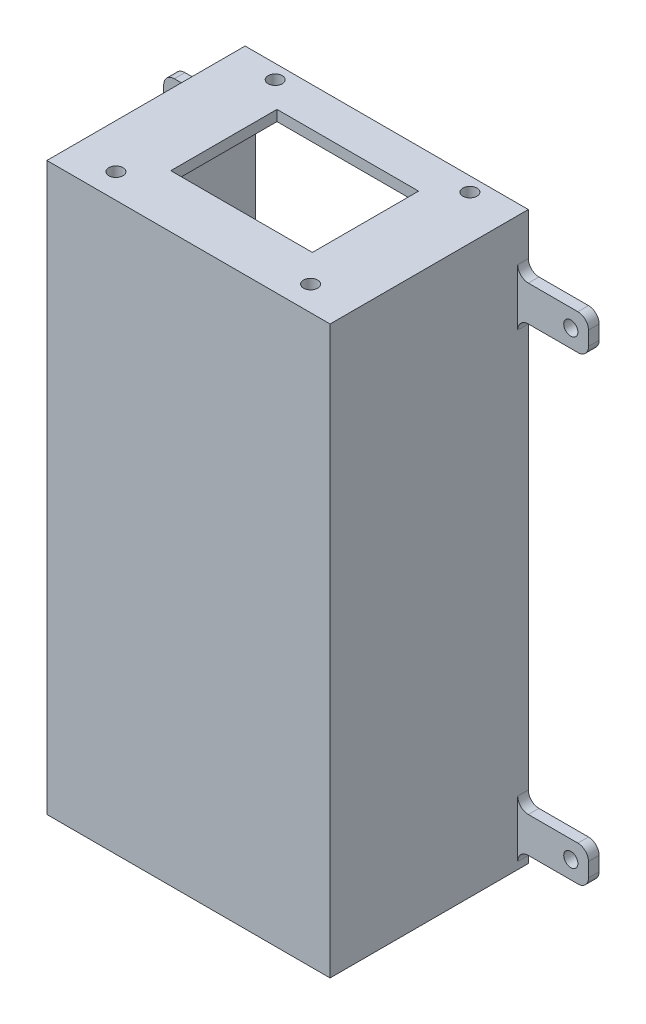
from build123d import *

# Parameters (mm, degrees)
SKETCH1_W           = 80
SKETCH1_H           = 160
BOSS_EXTRUDE1_DEPTH = 56
SHELL1_T            = -3
SKETCH2_W           = 40
SKETCH2_H           = 30
CUT_EXTRUDE1_DEPTH  = 70
SKETCH4_W           = 70
SKETCH4_H           = 15
CUT_EXTRUDE3_DEPTH  = 70
SKETCH5_W           = 20
SKETCH5_H           = 10
SKETCH5_R           = 2
BOSS_EXTRUDE2_DEPTH = 3
SKETCH6_R           = 2
CUT_EXTRUDE4_DEPTH  = 3
FILLET1_R           = 3


with BuildPart() as part:
    # Sketch1 → Boss-Extrude1 (new body)
    with BuildSketch(Plane.XY):
        Rectangle(SKETCH1_W, SKETCH1_H)
    extrude(amount=BOSS_EXTRUDE1_DEPTH)

    # Shell1
    shell1_openings = [part.faces().sort_by_distance(p)[0] for p in [
        (0, 0, 0),
    ]]
    offset(amount=SHELL1_T, openings=shell1_openings, kind=Kind.INTERSECTION)

    # Sketch2 → Cut-Extrude1 (cut)
    with BuildSketch(Plane(origin=(0, 80, 0), x_dir=(1, 0, 0), z_dir=(0, 1, 0))):
        with Locations((0, -26)):
            Rectangle(SKETCH2_W, SKETCH2_H)
    extrude(amount=-CUT_EXTRUDE1_DEPTH, mode=Mode.SUBTRACT)

    # Sketch4 → Cut-Extrude3 (cut)
    with BuildSketch(Plane(origin=(0, -80, 0), x_dir=(-1, 0, 0), z_dir=(0, -1, 0))):
        with Locations((0, -7.5)):
            Rectangle(SKETCH4_W, SKETCH4_H)
    extrude(amount=-CUT_EXTRUDE3_DEPTH, mode=Mode.SUBTRACT)

    # Sketch5 → Boss-Extrude2 (add)
    # profile 1 of 2: a face of its own
    with BuildSketch(Plane(origin=(0, 0, 0), x_dir=(-1, 0, 0), z_dir=(0, 0, -1))):
        with Locations((50, 60)):
            Rectangle(SKETCH5_W, SKETCH5_H)
        with Locations((55, 60)):
            Circle(SKETCH5_R, mode=Mode.SUBTRACT)
    # profile 2 of 2: a face of its own
    with BuildSketch(Plane(origin=(0, 0, 0), x_dir=(-1, 0, 0), z_dir=(0, 0, -1))):
        with Locations((50, -70)):
            Rectangle(SKETCH5_W, SKETCH5_H)
        with Locations((55, -70)):
            Circle(SKETCH5_R, mode=Mode.SUBTRACT)
    boss_extrude2 = extrude(amount=-BOSS_EXTRUDE2_DEPTH)

    # Mirror1: Boss-Extrude2 across plane
    add(boss_extrude2.mirror(Plane(origin=(0, 0, 0), x_dir=(0, 0, 1), z_dir=(1, 0, 0))))

    # Sketch6 → Cut-Extrude4 (cut)
    with BuildSketch(Plane(origin=(0, 80, 0), x_dir=(1, 0, 0), z_dir=(0, 1, 0))):
        with Locations(Location((-27.5, -4, 0), (0, 0, 270))):
            Circle(SKETCH6_R)
        with Locations(Location((27.5, -4, 0), (0, 0, 270))):
            Circle(SKETCH6_R)
        with Locations(Location((27.5, -49, 0), (0, 0, 270))):
            Circle(SKETCH6_R)
        with Locations(Location((-27.5, -49, 0), (0, 0, 270))):
            Circle(SKETCH6_R)
    extrude(amount=-CUT_EXTRUDE4_DEPTH, mode=Mode.SUBTRACT)

    # Fillet1
    fillet1_edges = [part.edges().sort_by_distance(p)[0] for p in [
        (40, 55, 1.5),
        (60, 55, 1.5),
        (60, 65, 1.5),
        (40, -65, 1.5),
        (40, -75, 1.5),
        (60, -75, 1.5),
        (60, -65, 1.5),
        (-35, -78.5, 15),
        (35, -78.5, 15),
        (-40, 55, 1.5),
        (-40, 65, 1.5),
        (-60, 65, 1.5),
        (-60, 55, 1.5),
        (-40, -75, 1.5),
        (-40, -65, 1.5),
        (-60, -65, 1.5),
        (-60, -75, 1.5),
        (40, 65, 1.5),
    ]]
    fillet(fillet1_edges, radius=FILLET1_R)


solid = part.part
